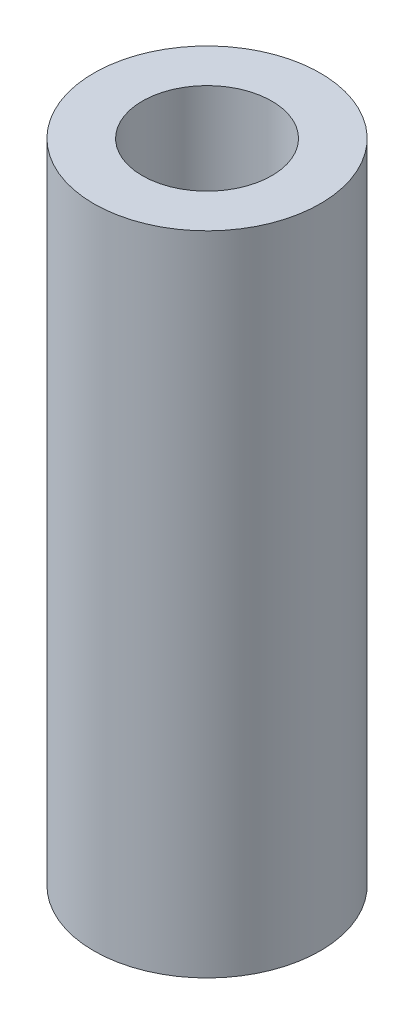
from build123d import *

# Parameters (mm, degrees)
SKETCH_1_R      = 3.5
SKETCH_1_R_2    = 2
EXTRUDE_1_DEPTH = 20


with BuildPart() as part:
    # 草图1 → 凸台-拉伸1 (new body)
    with BuildSketch(Plane(origin=(0, 0, 0), x_dir=(1, 0, 0), z_dir=(0, 1, 0))):
        with Locations(Location((0, 0, 0), (0, 0, 270))):
            Circle(SKETCH_1_R)
        with Locations(Location((0, 0, 0), (0, 0, 270))):
            Circle(SKETCH_1_R_2, mode=Mode.SUBTRACT)
    extrude(amount=EXTRUDE_1_DEPTH)


solid = part.part
